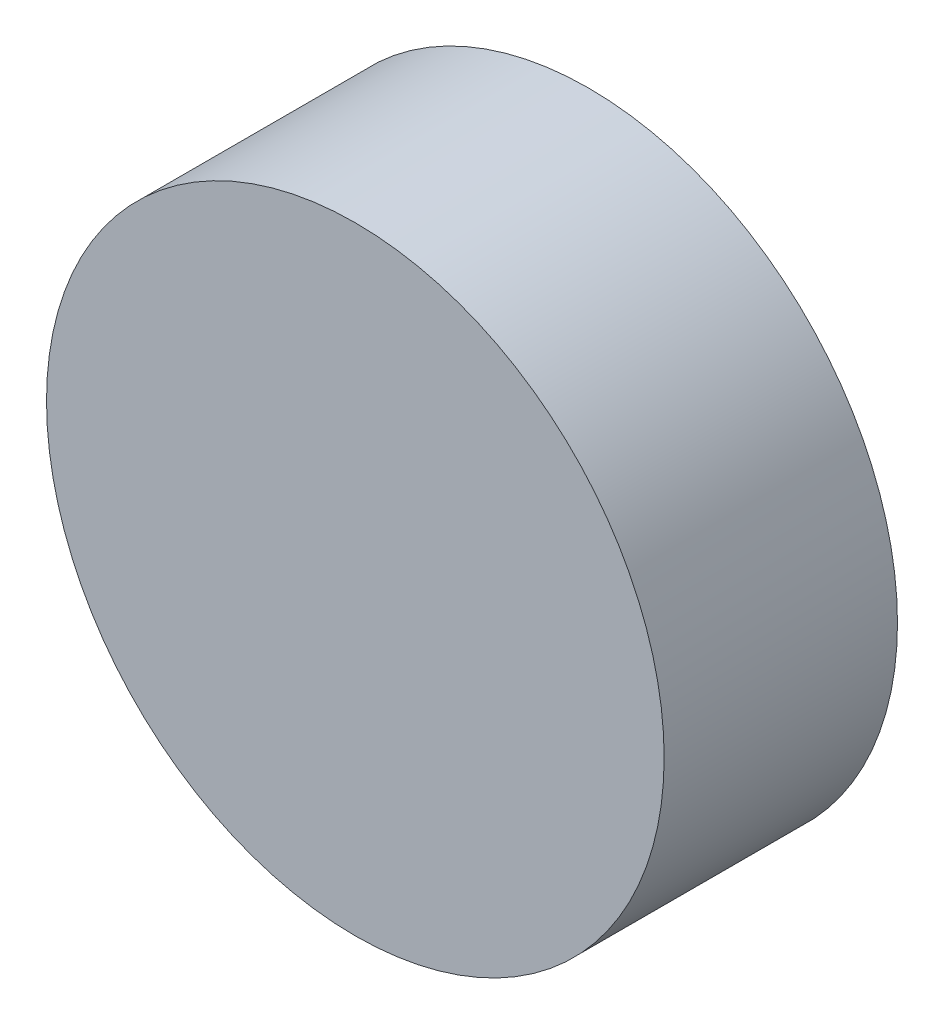
from build123d import *

# Parameters (mm, degrees)
SKETCH1_R           = 2.25
BOSS_EXTRUDE1_DEPTH = 1.7


with BuildPart() as part:
    # Sketch1 → Boss-Extrude1 (new body)
    with BuildSketch(Plane.XY):
        Circle(SKETCH1_R)
    extrude(amount=BOSS_EXTRUDE1_DEPTH)


solid = part.part
